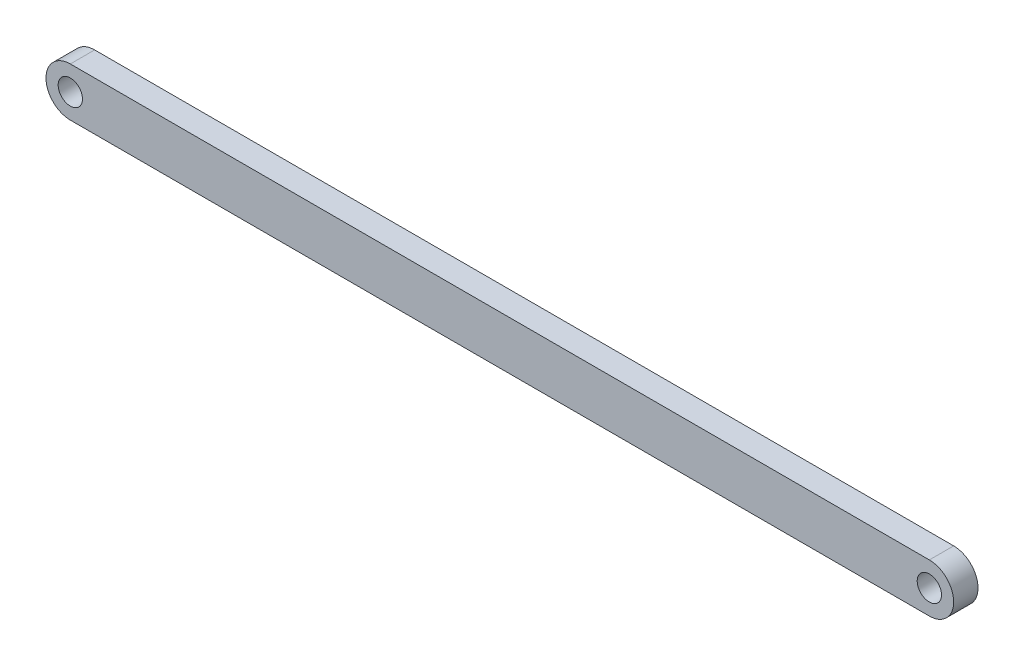
from build123d import *

# Parameters (mm, degrees)
SKETCH1_R           = 3.175
BOSS_EXTRUDE1_DEPTH = 6.35


with BuildPart() as part:
    # Sketch1 → Boss-Extrude1 (new body)
    with BuildSketch(Plane.XY):
        with BuildLine():
            Line((-112.141, 6.35), (112.141, 6.35))
            ThreePointArc((112.141, 6.35), (118.491, 0), (112.141, -6.35))
            Line((112.141, -6.35), (-112.141, -6.35))
            ThreePointArc((-112.141, -6.35), (-118.491, 0), (-112.141, 6.35))
        make_face()
        with Locations((-112.141, 0)):
            Circle(SKETCH1_R, mode=Mode.SUBTRACT)
        with Locations((112.141, 0)):
            Circle(SKETCH1_R, mode=Mode.SUBTRACT)
    extrude(amount=BOSS_EXTRUDE1_DEPTH)


solid = part.part
